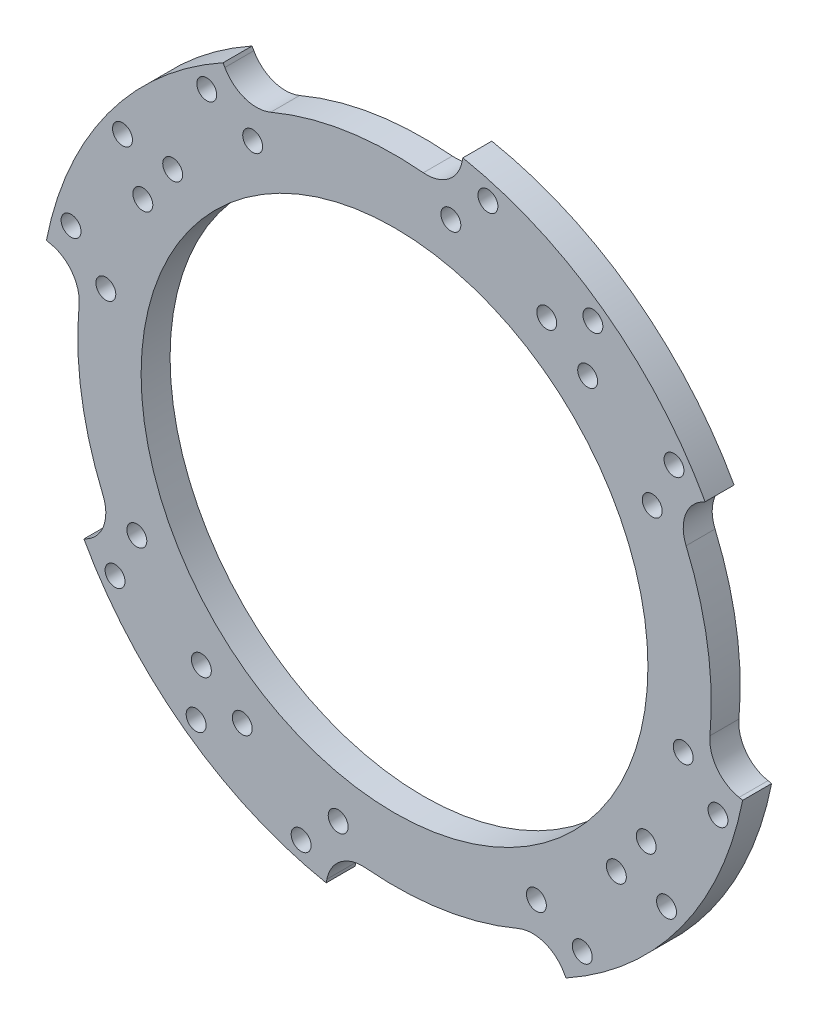
from build123d import *

# Parameters (mm, degrees)
SKETCH_1_R               = 87.5
SKETCH_1_R_2             = 70
EXTRUDE_1_DEPTH          = 8
SKETCH_2_R               = 2.75
CUT_EXTRUDE_1_DEPTH      = 10
PATTERN_CIRCULAR_1_COUNT = 4
EXTRUDE_START            = -8
SKETCH_3_R               = 2.75
EXTRUDE_2_DEPTH          = 8
PATTERN_CIRCULAR_2_COUNT = 4
FILLET_1_R               = 10


with BuildPart() as part:
    # 草图1 → 凸台-拉伸1 (new body)
    with BuildSketch(Plane.XY):
        Circle(SKETCH_1_R)
        Circle(SKETCH_1_R_2, mode=Mode.SUBTRACT)
    extrude(amount=EXTRUDE_1_DEPTH)

    # 草图2 → 切除-拉伸1 (cut)
    with BuildSketch(Plane.XY.offset(8)):
        with Locations((42.051550898, 69.52143243)):
            Circle(SKETCH_2_R)
        with Locations((53.351997363, 61.27909005)):
            Circle(SKETCH_2_R)
        with Locations((71.178427561, 39.181551143)):
            Circle(SKETCH_2_R)
        with Locations((15.564640034, 79.745247386)):
            Circle(SKETCH_2_R)
    cut_extrude_1 = extrude(amount=-CUT_EXTRUDE_1_DEPTH, mode=Mode.SUBTRACT)

    # 阵列(圆周)1: 切除-拉伸1 ×4 about axis
    pattern_circular_1_axis = Axis((0, 0, 0), (0, 0, 1))
    for i in range(1, PATTERN_CIRCULAR_1_COUNT):
        add(cut_extrude_1.rotate(pattern_circular_1_axis, i * 360 / PATTERN_CIRCULAR_1_COUNT), mode=Mode.SUBTRACT)

    # 草图3 → 凸台-拉伸2 (add)
    with BuildSketch(Plane.XY.offset(8).offset(EXTRUDE_START)):
        with BuildLine():
            Line((-42.278733745, 76.607823836), (-47.352181794, 85.800762697))
            ThreePointArc((-47.352181794, 85.800762697), (-79.17662028, 57.750002606), (-96.164593228, 18.87779143))
            Line((-96.164593228, 18.87779143), (-85.861243954, 16.85517092))
            ThreePointArc((-85.861243954, 16.85517092), (-70.693410964, 51.562502327), (-42.278733745, 76.607823836))
        make_face()
        with Locations((-89.349607638, 25.800147575)):
            Circle(SKETCH_3_R, mode=Mode.SUBTRACT)
        with Locations((-51.861755237, 77.196880402)):
            Circle(SKETCH_3_R, mode=Mode.SUBTRACT)
        with Locations((-75.136996797, 54.803573902)):
            Circle(SKETCH_3_R, mode=Mode.SUBTRACT)
    extrude_2 = extrude(amount=EXTRUDE_2_DEPTH)

    # 阵列(圆周)2: 凸台-拉伸2 ×4 about axis
    pattern_circular_2_axis = Axis((0, 0, 0), (0, 0, 1))
    for i in range(1, PATTERN_CIRCULAR_2_COUNT):
        add(extrude_2.rotate(pattern_circular_2_axis, i * 360 / PATTERN_CIRCULAR_2_COUNT))

    # 圆角1
    fillet_1_edges = [part.edges().sort_by_distance(p)[0] for p in [
        (-16.85517092, -85.861243954, 4),
        (-76.607823836, -42.278733745, 4),
        (85.861243954, -16.85517092, 4),
        (42.278733745, -76.607823836, 4),
        (16.85517092, 85.861243954, 4),
        (76.607823836, 42.278733745, 4),
        (-85.861243954, 16.85517092, 4),
        (-42.278733745, 76.607823836, 4),
    ]]
    fillet(fillet_1_edges, radius=FILLET_1_R)


solid = part.part
